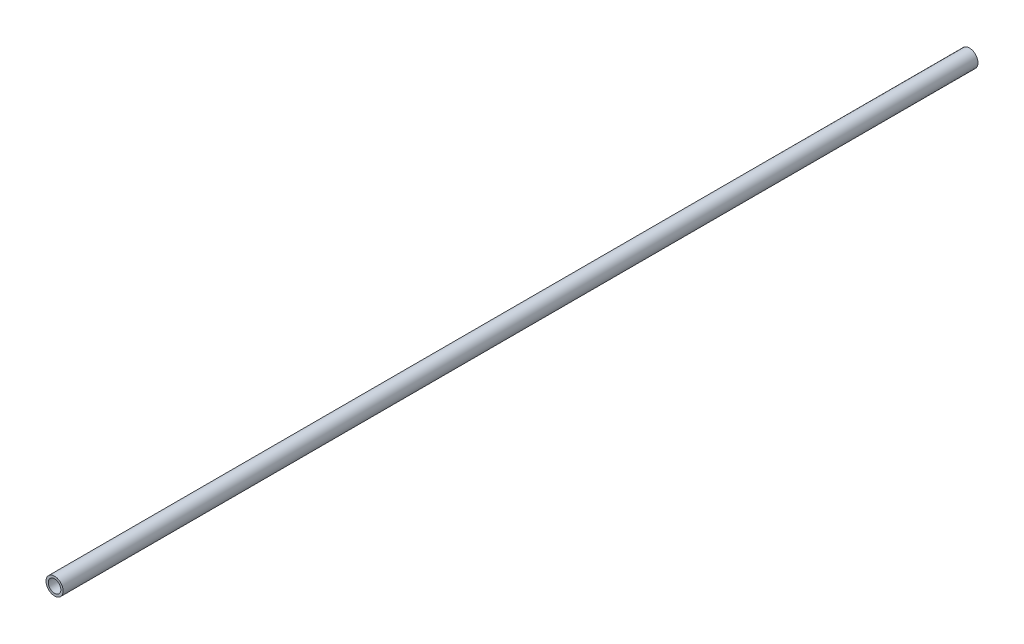
from build123d import *

# Parameters (mm, degrees)
SKETCH1_R           = 3.75
SKETCH1_R_2         = 2.75
BOSS_EXTRUDE1_DEPTH = 400


with BuildPart() as part:
    # Sketch1 → Boss-Extrude1 (new body)
    with BuildSketch(Plane.XY):
        with Locations((-32.899281496, 249.847725303)):
            Circle(SKETCH1_R)
        with Locations((-32.899281496, 249.847725303)):
            Circle(SKETCH1_R_2, mode=Mode.SUBTRACT)
    extrude(amount=BOSS_EXTRUDE1_DEPTH)


solid = part.part
